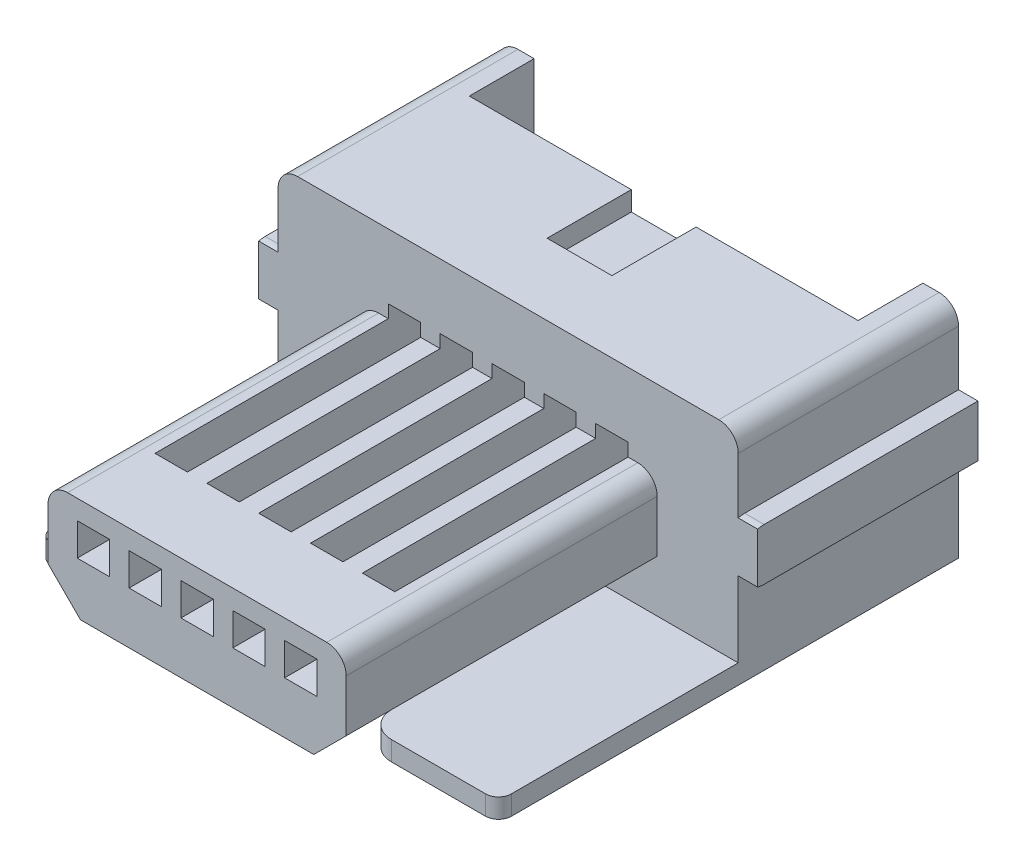
from build123d import *

# Parameters (mm, degrees)
BOSS_EXTRUDE1_DEPTH = 8.2
BOSS_EXTRUDE2_DEPTH = 3.85
SKETCH3_OUTSIDE_W   = 12.05
SKETCH3_OUTSIDE_H   = 7.75
CUT_EXTRUDE1_DEPTH  = 4.8
SKETCH4_W           = 1
SKETCH4_H           = 0.3
CUT_EXTRUDE3_DEPTH  = 2.3
CUT_EXTRUDE6_DEPTH  = 10.675872054
SKETCH6_W           = 0.5
SKETCH6_H           = 0.5
CUT_EXTRUDE7_DEPTH  = 2
SKETCH7_W           = 0.5
SKETCH7_H           = 0.8
CUT_EXTRUDE8_DEPTH  = 7
SKETCH8_W           = 6
SKETCH8_H           = 1
CUT_EXTRUDE9_DEPTH  = 2
SKETCH9_W           = 6
SKETCH9_H           = 0.5
CUT_EXTRUDE10_DEPTH = 1
SKETCH10_R          = 0.4
BOSS_EXTRUDE3_DEPTH = 1.1
CHAMFER1_SIZE       = 0.2
SKETCH11_W          = 7.1
SKETCH11_H          = 0.3
BOSS_EXTRUDE4_DEPTH = 3.7
FILLET1_R           = 0.2
SKETCH12_W          = 3
SKETCH12_H          = 2
CUT_EXTRUDE11_DEPTH = 0.5
FILLET2_R           = 0.2
FILLET3_R           = 0.4


with BuildPart() as part:
    # Sketch1 → Boss-Extrude1 (new body)
    with BuildSketch(Plane.XY):
        with BuildLine():
            Line((-3.25, 3.4), (3.25, 3.4))
            ThreePointArc((3.25, 3.4), (3.462132034, 3.312132034), (3.55, 3.1))
            Line((3.55, 3.1), (3.55, 0))
            Line((3.55, 0), (-3.55, 0))
            Line((-3.55, 0), (-3.55, 3.1))
            ThreePointArc((-3.55, 3.1), (-3.462132034, 3.312132034), (-3.25, 3.4))
        make_face()
    extrude(amount=BOSS_EXTRUDE1_DEPTH)

    # Sketch2 → Boss-Extrude2 (add, symmetric)
    with BuildSketch(Plane(origin=(0, 0, 0), x_dir=(0, 0, -1), z_dir=(1, 0, 0))):
        with BuildLine():
            Line((0, 2.25), (-3.3, 2.25))
            ThreePointArc((-3.3, 2.25), (-3.7, 1.85), (-3.3, 1.45))
            Line((-3.3, 1.45), (0, 1.45))
            Line((0, 1.45), (0, 2.25))
        make_face()
    extrude(amount=BOSS_EXTRUDE2_DEPTH, both=True)

    # Sketch3 outside → Cut-Extrude1 (cut)
    with BuildSketch(Plane.XY.offset(8.2)):
        with Locations((0, 1.7)):
            Rectangle(SKETCH3_OUTSIDE_W, SKETCH3_OUTSIDE_H)
        with BuildLine():
            Line((-2, 2.2), (2, 2.2))
            ThreePointArc((2, 2.2), (2.212132034, 2.112132034), (2.3, 1.9))
            Line((2.3, 1.9), (2.3, 1.1))
            Line((2.3, 1.1), (1.8, 0.6))
            Line((1.8, 0.6), (-1.8, 0.6))
            Line((-1.8, 0.6), (-2.3, 1.1))
            Line((-2.3, 1.1), (-2.3, 1.9))
            ThreePointArc((-2.3, 1.9), (-2.212132034, 2.112132034), (-2, 2.2))
        make_face(mode=Mode.SUBTRACT)
    extrude(amount=-CUT_EXTRUDE1_DEPTH, mode=Mode.SUBTRACT)

    # Sketch4 → Cut-Extrude3 (cut)
    with BuildSketch(Plane.XY):
        with Locations((0, 3.25)):
            Rectangle(SKETCH4_W, SKETCH4_H)
    extrude(amount=CUT_EXTRUDE3_DEPTH, mode=Mode.SUBTRACT)

    # Sketch5 → Cut-Extrude6 (cut, through all)
    with BuildSketch(Plane(origin=(0, 0, 0), x_dir=(1, 0, 0), z_dir=(0, 1, 0))):
        Polygon((-1.85, 0), (1.85, 0), (1.85, -1), (1.35, -1), (1.35, -0.7), (1.05, -0.7), (1.05, -1), (0.55, -1), (0.55, -0.7), (0.25, -0.7), (0.25, -1), (-0.25, -1), (-0.25, -0.7), (-0.55, -0.7), (-0.55, -1), (-1.05, -1), (-1.05, -0.7), (-1.35, -0.7), (-1.35, -1), (-1.85, -1), align=None)
    extrude(amount=CUT_EXTRUDE6_DEPTH, mode=Mode.SUBTRACT)

    # Sketch6 → Cut-Extrude7 (cut)
    with BuildSketch(Plane.XY.offset(8.2)):
        with Locations((1.6, 1.65)):
            Rectangle(SKETCH6_W, SKETCH6_H)
        with Locations((0.8, 1.65)):
            Rectangle(SKETCH6_W, SKETCH6_H)
        with Locations((0, 1.65)):
            Rectangle(SKETCH6_W, SKETCH6_H)
        with Locations((-0.8, 1.65)):
            Rectangle(SKETCH6_W, SKETCH6_H)
        with Locations((-1.6, 1.65)):
            Rectangle(SKETCH6_W, SKETCH6_H)
    extrude(amount=-CUT_EXTRUDE7_DEPTH, mode=Mode.SUBTRACT)

    # Sketch7 → Cut-Extrude8 (cut)
    with BuildSketch(Plane.XY):
        with Locations((1.6, 2)):
            Rectangle(SKETCH7_W, SKETCH7_H)
        with Locations((0.8, 2)):
            Rectangle(SKETCH7_W, SKETCH7_H)
        with Locations((0, 2)):
            Rectangle(SKETCH7_W, SKETCH7_H)
        with Locations((-0.8, 2)):
            Rectangle(SKETCH7_W, SKETCH7_H)
        with Locations((-1.6, 2)):
            Rectangle(SKETCH7_W, SKETCH7_H)
    extrude(amount=CUT_EXTRUDE8_DEPTH, mode=Mode.SUBTRACT)

    # Sketch8 → Cut-Extrude9 (cut)
    with BuildSketch(Plane(origin=(0, 3.4, 0), x_dir=(1, 0, 0), z_dir=(0, 1, 0))):
        with Locations((0, -0.5)):
            Rectangle(SKETCH8_W, SKETCH8_H)
    extrude(amount=-CUT_EXTRUDE9_DEPTH, mode=Mode.SUBTRACT)

    # Sketch9 → Cut-Extrude10 (cut)
    with BuildSketch(Plane.XY):
        with Locations((0, 0.25)):
            Rectangle(SKETCH9_W, SKETCH9_H)
    extrude(amount=CUT_EXTRUDE10_DEPTH, mode=Mode.SUBTRACT)

    # Sketch10 → Boss-Extrude3 (add)
    with BuildSketch(Plane.XZ):
        with Locations(Location((2.2, 3.05, 0), (0, 0, 118.955024372))):
            Circle(SKETCH10_R)
        with Locations(Location((-2.2, 3.05, 0), (0, 0, 118.955024372))):
            Circle(SKETCH10_R)
    extrude(amount=BOSS_EXTRUDE3_DEPTH)

    # Chamfer1
    chamfer1_edges = [part.edges().sort_by_distance(p)[0] for p in [
        (2.393649167, -1.1, 2.7),
        (-2.006350833, -1.1, 2.7),
    ]]
    chamfer(chamfer1_edges, length=CHAMFER1_SIZE)

    # Sketch11 → Boss-Extrude4 (add)
    with BuildSketch(Plane.XY.offset(3.4)):
        with Locations((0, 0.15)):
            Rectangle(SKETCH11_W, SKETCH11_H)
    extrude(amount=BOSS_EXTRUDE4_DEPTH)

    # Fillet1
    fillet1_edges = [part.edges().sort_by_distance(p)[0] for p in [
        (-3.55, 0.15, 7.1),
        (3.55, 0.15, 7.1),
    ]]
    fillet(fillet1_edges, radius=FILLET1_R)

    # Sketch12 → Cut-Extrude11 (cut)
    with BuildSketch(Plane.XZ):
        with Locations((0, 6.1)):
            Rectangle(SKETCH12_W, SKETCH12_H)
    extrude(amount=-CUT_EXTRUDE11_DEPTH, mode=Mode.SUBTRACT)

    # Fillet2
    fillet2_edges = [part.edges().sort_by_distance(p)[0] for p in [
        (1.5, 0.15, 5.1),
        (-1.5, 0.15, 5.1),
    ]]
    fillet(fillet2_edges, radius=FILLET2_R)

    # Fillet3
    fillet3_edges = [part.edges().sort_by_distance(p)[0] for p in [
        (1.5, 0.15, 7.1),
        (-1.5, 0.15, 7.1),
    ]]
    fillet(fillet3_edges, radius=FILLET3_R)


solid = part.part
